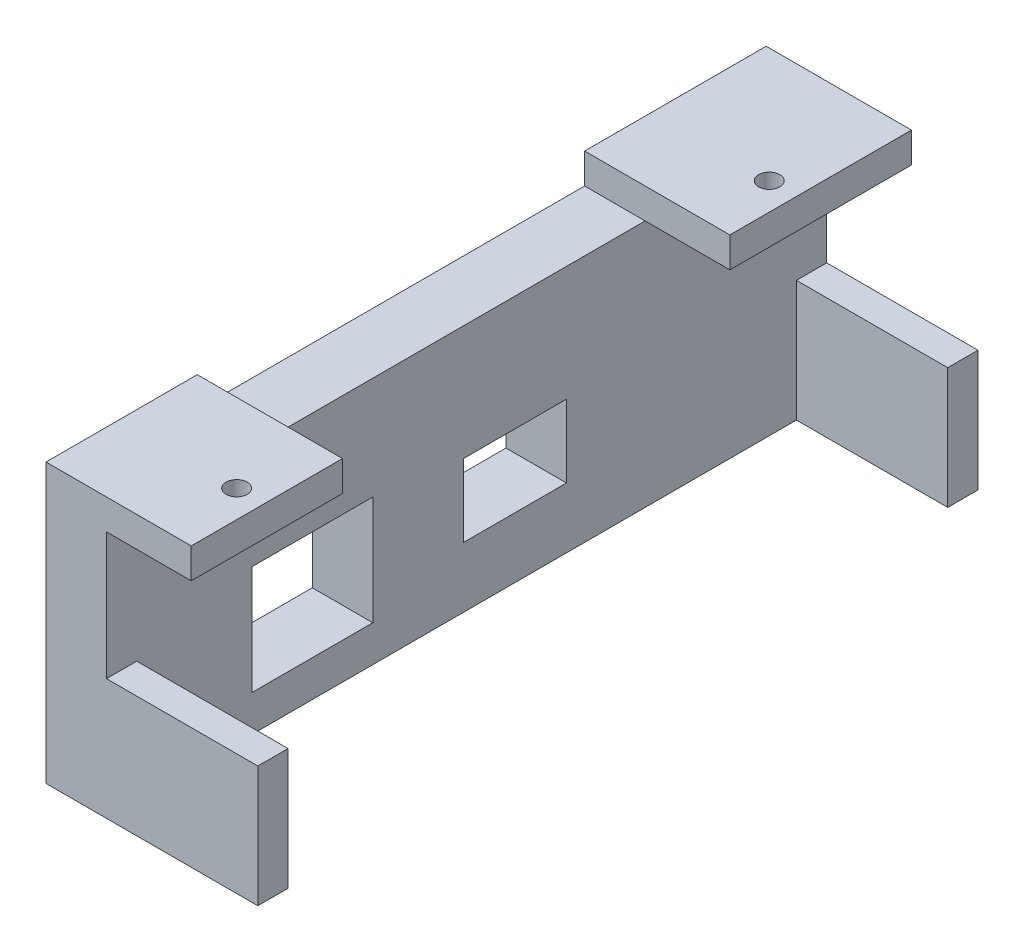
from build123d import *

# Parameters (mm, degrees)
SKETCH1_W      = 10
SKETCH1_H      = 119
EXTRUDE1_DEPTH = 46
SKETCH2_W      = 5
SKETCH2_H      = 20
EXTRUDE2_DEPTH = 35
SKETCH3_W      = 64
SKETCH3_H      = 5
SKETCH3_W_2    = 17
SKETCH3_H_2    = 12
SKETCH3_W_3    = 20
SKETCH3_H_3    = 18
EXTRUDE3_DEPTH = 30
SKETCH4_W      = 25
SKETCH4_H      = 5
SKETCH4_W_2    = 30
EXTRUDE4_DEPTH = 14
SKETCH5_R      = 1.75
EXTRUDE5_DEPTH = 5
SKETCH7_R      = 2
EXTRUDE6_DEPTH = 10


with BuildPart() as part:
    # Sketch1 → Extrude1 (new body)
    with BuildSketch(Plane(origin=(0, 0, 0), x_dir=(1, 0, 0), z_dir=(0, 1, 0))):
        Rectangle(SKETCH1_W, SKETCH1_H)
    extrude(amount=EXTRUDE1_DEPTH)

    # Sketch2 → Extrude2 (add)
    with BuildSketch(Plane.ZY.offset(5)):
        with Locations((-57, 10)):
            Rectangle(SKETCH2_W, SKETCH2_H)
        with Locations((57, 10)):
            Rectangle(SKETCH2_W, SKETCH2_H)
    extrude(amount=-EXTRUDE2_DEPTH)

    # Sketch3 → Extrude3 (cut)
    with BuildSketch(Plane.ZY.offset(5)):
        with Locations((2.5, 43.5)):
            Rectangle(SKETCH3_W, SKETCH3_H)
        with Locations((-8, 16)):
            Rectangle(SKETCH3_W_2, SKETCH3_H_2)
        with Locations((25.5, 15)):
            Rectangle(SKETCH3_W_3, SKETCH3_H_3)
    extrude(amount=-EXTRUDE3_DEPTH, mode=Mode.SUBTRACT)

    # Sketch4 → Extrude4 (add)
    with BuildSketch(Plane(origin=(5, 0, 0), x_dir=(0, 0, -1), z_dir=(1, 0, 0))):
        with Locations((-47, 43.5)):
            Rectangle(SKETCH4_W, SKETCH4_H)
        with Locations((44.5, 43.5)):
            Rectangle(SKETCH4_W_2, SKETCH4_H)
    extrude(amount=EXTRUDE4_DEPTH)

    # Sketch5 → Extrude5 (cut)
    with BuildSketch(Plane(origin=(0, 46, 0), x_dir=(1, 0, 0), z_dir=(0, 1, 0))):
        with Locations(Location((14.5, -47.5, 0), (0, 0, 270))):
            Circle(SKETCH5_R)
        with Locations(Location((14.5, 40.5, 0), (0, 0, 270))):
            Circle(SKETCH5_R)
    extrude(amount=-EXTRUDE5_DEPTH, mode=Mode.SUBTRACT)

    # Sketch7 → Extrude6 (cut)
    with BuildSketch(Plane.XZ):
        with Locations(Location((0, 45, 0), (0, 0, 270))):
            Circle(SKETCH7_R)
        with Locations(Location((0, -45, 0), (0, 0, 270))):
            Circle(SKETCH7_R)
    extrude(amount=-EXTRUDE6_DEPTH, mode=Mode.SUBTRACT)


solid = part.part
